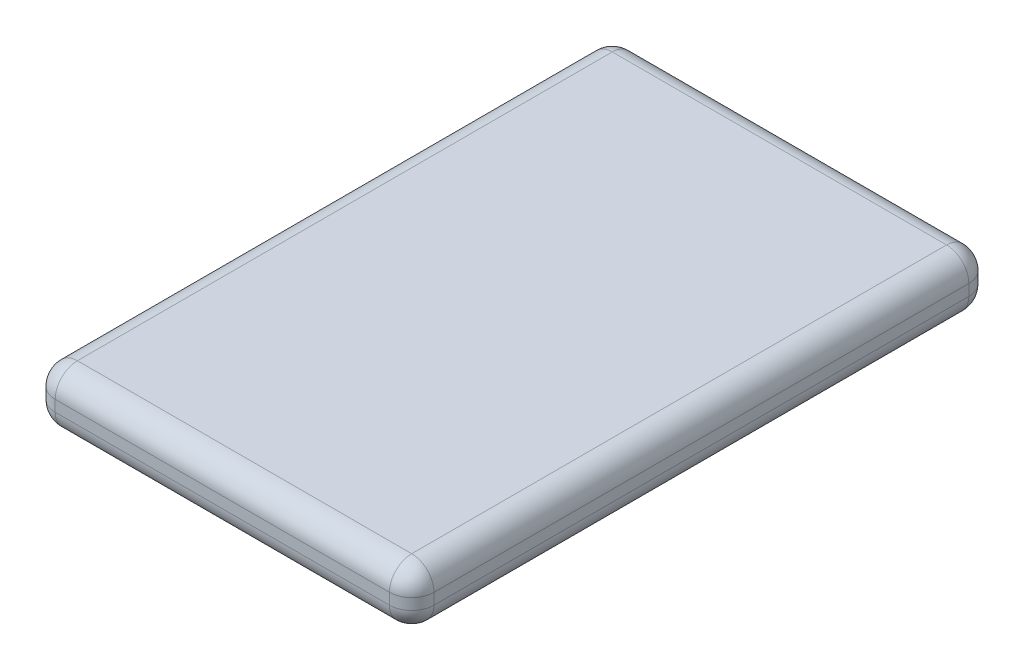
from build123d import *

# Parameters (mm, degrees)
SKETCH1_W           = 34
SKETCH1_H           = 52
BOSS_EXTRUDE1_DEPTH = 5
FILLET1_R           = 2


with BuildPart() as part:
    # Sketch1 → Boss-Extrude1 (new body)
    with BuildSketch(Plane(origin=(0, 0, 0), x_dir=(1, 0, 0), z_dir=(0, 1, 0))):
        with Locations((17, 26)):
            Rectangle(SKETCH1_W, SKETCH1_H)
    extrude(amount=BOSS_EXTRUDE1_DEPTH)

    # Fillet1
    fillet1_edges = [part.edges().sort_by_distance(p)[0] for p in [
        (34, 5, -26),
        (17, 5, -52),
        (0, 5, -26),
        (17, 0, -52),
        (34, 0, -26),
        (17, 0, 0),
        (0, 0, -26),
        (0, 2.5, -52),
        (34, 2.5, -52),
        (34, 2.5, 0),
        (0, 2.5, 0),
        (17, 5, 0),
    ]]
    fillet(fillet1_edges, radius=FILLET1_R)


solid = part.part
